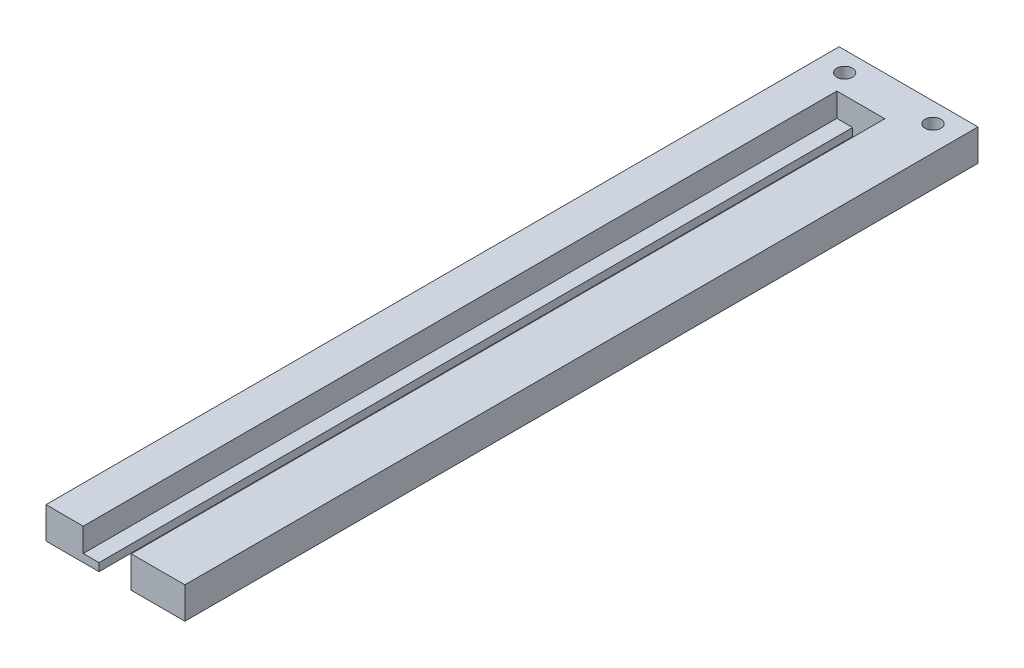
from build123d import *

# Parameters (mm, degrees)
SKETCH1_W           = 27.94
SKETCH1_H           = 6.35
BOSS_EXTRUDE1_DEPTH = 7.9502
SKETCH2_W           = 10.795
SKETCH2_H           = 6.35
BOSS_EXTRUDE2_DEPTH = 151.60625
SKETCH4_R           = 1.5875
CUT_EXTRUDE1_DEPTH  = 161.292682729


with BuildPart() as part:
    # Sketch1 → Boss-Extrude1 (new body)
    with BuildSketch(Plane.XY):
        Rectangle(SKETCH1_W, SKETCH1_H)
    extrude(amount=BOSS_EXTRUDE1_DEPTH)

    # Sketch2 → Boss-Extrude2 (add)
    with BuildSketch(Plane.XY.offset(7.9502)):
        Polygon((-3.302, -3.175), (-3.302, -1.5875), (-6.477, -1.5875), (-6.477, 3.175), (-13.97, 3.175), (-13.97, -3.175), align=None)
        with Locations((8.5725, 0)):
            Rectangle(SKETCH2_W, SKETCH2_H)
    extrude(amount=BOSS_EXTRUDE2_DEPTH)

    # Sketch4 → Cut-Extrude1 (cut, through all)
    with BuildSketch(Plane(origin=(0, 3.175, 0), x_dir=(1, 0, 0), z_dir=(0, 1, 0))):
        with Locations(Location((-8.89, -3.9751, 0), (0, 0, 270))):
            Circle(SKETCH4_R)
        with Locations(Location((8.89, -3.9751, 0), (0, 0, 270))):
            Circle(SKETCH4_R)
    extrude(amount=-CUT_EXTRUDE1_DEPTH, mode=Mode.SUBTRACT)


solid = part.part
